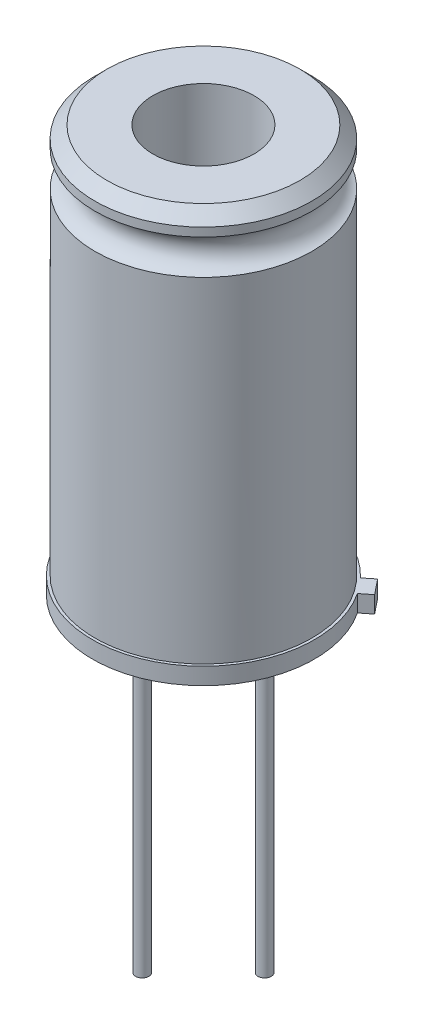
from build123d import *

# Parameters (mm, degrees)
ESBO_O2_R                = 4.5
RESSALTO_EXTRUS_O1_DEPTH = 16.2
ESBO_O3_R                = 2.1
CORTE_EXTRUS_O2_DEPTH    = 13.2
ESBO_O5_R                = 0.75
RESSALTO_EXTRUS_O2_DEPTH = 0.7
ESBO_O11_R               = 0.8
CORTE_EXTRUS_O3_DEPTH    = 0.7
ESBO_O8_R                = 0.275
RESSALTO_EXTRUS_O3_DEPTH = 13


with BuildPart() as part:
    # Esboço2 → Ressalto-extrusão1 (new body)
    with BuildSketch(Plane(origin=(0, 0, 0), x_dir=(1, 0, 0), z_dir=(0, 1, 0))):
        with Locations(Location((0, 0, 0), (0, 0, 270))):
            Circle(ESBO_O2_R)
    extrude(amount=RESSALTO_EXTRUS_O1_DEPTH)

    # Esboço3 → Corte-extrusão2 (cut)
    with BuildSketch(Plane(origin=(0, 16.2, 0), x_dir=(1, 0, 0), z_dir=(0, 1, 0))):
        with Locations(Location((0, 0, 0), (0, 0, 270))):
            Circle(ESBO_O3_R)
    extrude(amount=-CORTE_EXTRUS_O2_DEPTH, mode=Mode.SUBTRACT)

    # Esboço5 → Corte-Revolução1 (revolve, cut)
    with BuildSketch(Plane(origin=(0, 0, 0), x_dir=(0, 0, -1), z_dir=(1, 0, 0)), mode=Mode.PRIVATE) as corte_revolu_o1_sk:
        with Locations((4.7, 14.62)):
            Circle(ESBO_O5_R)
    revolve(corte_revolu_o1_sk.sketch.rotate(Axis((0, 16.2, 0), (0, -1, 0)), 180), axis=Axis((0, 16.2, 0), (0, -1, 0)), mode=Mode.SUBTRACT)

    # Esboço12 → Ressalto-extrusão2 (add)
    with BuildSketch(Plane.XZ):
        with BuildLine():
            Line((3.342126206, -3.174726822), (3.73922223, -3.491162716))
            Line((3.73922223, -3.491162716), (4.237785194, -2.865515075))
            Line((4.237785194, -2.865515075), (3.84068917, -2.549079181))
            ThreePointArc((3.84068917, -2.549079181), (-3.605005954, 2.87273912), (3.342126206, -3.174726822))
        make_face()
    extrude(amount=RESSALTO_EXTRUS_O2_DEPTH)

    # Esboço11 → Corte-extrusão3 (cut)
    with BuildSketch(Plane(origin=(0, 0, 0), x_dir=(1, 0, 0), z_dir=(0, 1, 0))):
        with Locations(Location((2.54, 0, 0), (0, 0, 270))):
            Circle(ESBO_O11_R)
        with Locations(Location((0, -2.54, 0), (0, 0, 270))):
            Circle(ESBO_O11_R)
        with Locations(Location((-2.54, 0, 0), (0, 0, 270))):
            Circle(ESBO_O11_R)
        with Locations(Location((0, 2.54, 0), (0, 0, 270))):
            Circle(ESBO_O11_R)
    extrude(amount=-CORTE_EXTRUS_O3_DEPTH, mode=Mode.SUBTRACT)

    # Esboço8 → Ressalto-extrusão3 (add)
    with BuildSketch(Plane(origin=(0, 0, 0), x_dir=(-1, 0, 0), z_dir=(0, -1, 0))):
        with Locations(Location((-2.54, 0, 0), (0, 0, 270))):
            Circle(ESBO_O8_R)
        with Locations(Location((0, 2.54, 0), (0, 0, 270))):
            Circle(ESBO_O8_R)
        with Locations(Location((2.54, 0, 0), (0, 0, 270))):
            Circle(ESBO_O8_R)
        with Locations(Location((0, -2.54, 0), (0, 0, 270))):
            Circle(ESBO_O8_R)
    extrude(amount=RESSALTO_EXTRUS_O3_DEPTH)

    # Esboço15 → Corte-Revolução2 (revolve, cut)
    with BuildSketch(Plane(origin=(0, 0, 0), x_dir=(0, 0, -1), z_dir=(1, 0, 0))):
        Polygon((4.5, 16.20375847), (4.5, 15.70375847), (4.000000985, 16.204750978), align=None)
    revolve(axis=Axis((0, 16.204750978, 0), (0, 1, 0)), mode=Mode.SUBTRACT)


solid = part.part
